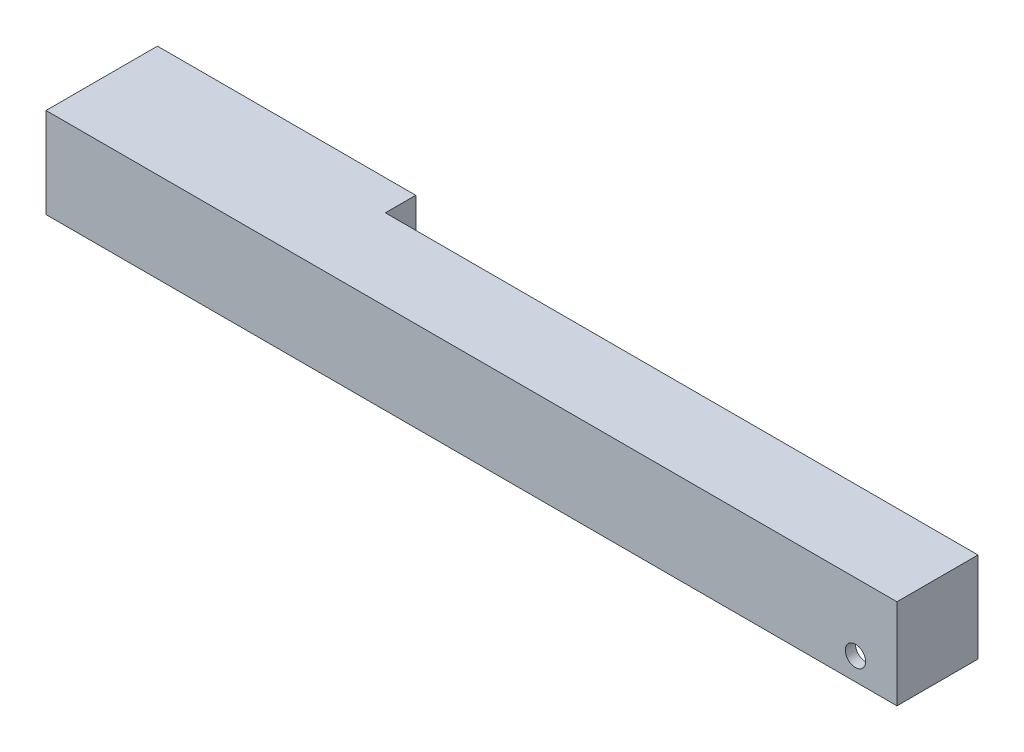
from build123d import *

# Parameters (mm, degrees)
SKETCH1_W           = 168
SKETCH1_H           = 22
BOSS_EXTRUDE1_DEPTH = 17.8
SKETCH8_R           = 2
CUT_EXTRUDE4_DEPTH  = 22
CUT_EXTRUDE2_REACH  = 88.567
SKETCH5_W           = 117
SKETCH5_H           = 6
CUT_EXTRUDE3_DEPTH  = 15.8
BOSS_EXTRUDE3_REACH = 90.164
SKETCH7_W           = 47
SKETCH7_H           = 2


with BuildPart() as part:
    # Sketch1 → Boss-Extrude1 (new body)
    with BuildSketch(Plane(origin=(0, 0, 0), x_dir=(1, 0, 0), z_dir=(0, 1, 0))):
        Rectangle(SKETCH1_W, SKETCH1_H)
    extrude(amount=-BOSS_EXTRUDE1_DEPTH)

    # Sketch8 → Cut-Extrude4 (cut)
    with BuildSketch(Plane.XY.offset(11)):
        with Locations((75.8, -13.35)):
            Circle(SKETCH8_R)
    extrude(amount=-CUT_EXTRUDE4_DEPTH, mode=Mode.SUBTRACT)

    # Cut-Extrude2: up to this face of the body (flat: up to its plane)
    cut_extrude2_end = Plane(part.part.faces().sort_by_distance((0, -17.8, 0))[0])
    # Sketch5 → Cut-Extrude2 (cut, up to the picked face)
    with BuildSketch(Plane(origin=(0, 0, 0), x_dir=(1, 0, 0), z_dir=(0, 1, 0)), mode=Mode.PRIVATE) as cut_extrude2_sk1:
        with Locations((25.5, 8)):
            Rectangle(SKETCH5_W, SKETCH5_H)
    cut_extrude2_tool1 = split(extrude(cut_extrude2_sk1.sketch, amount=-CUT_EXTRUDE2_REACH, mode=Mode.PRIVATE), bisect_by=cut_extrude2_end, keep=Keep.BOTH, mode=Mode.PRIVATE)
    add(cut_extrude2_tool1.solids().sort_by(Axis((25.5, 0, -8), (0, -1, 0)))[0], mode=Mode.SUBTRACT)

    # Sketch6 → Cut-Extrude3 (cut)
    with BuildSketch(Plane.XZ.offset(17.8)):
        Polygon((-82, 9), (-82, -9), (-35, -9), (-35, -3), (82, -3), (82, 9), align=None)
    extrude(amount=-CUT_EXTRUDE3_DEPTH, mode=Mode.SUBTRACT)

    # Boss-Extrude3: up to this face of the body (flat: up to its plane)
    boss_extrude3_end = Plane(part.part.faces().sort_by_distance((-0.369393652, -9.883187228, 9))[0])
    # Sketch7 → Boss-Extrude3 (add, up to the picked face)
    with BuildSketch(Plane.XY.offset(-9), mode=Mode.PRIVATE) as boss_extrude3_sk1:
        with Locations((-58.5, -13.3)):
            Rectangle(SKETCH7_W, SKETCH7_H)
    boss_extrude3_tool1 = split(extrude(boss_extrude3_sk1.sketch, amount=BOSS_EXTRUDE3_REACH, mode=Mode.PRIVATE), bisect_by=boss_extrude3_end, keep=Keep.BOTH, mode=Mode.PRIVATE)
    add(boss_extrude3_tool1.solids().sort_by(Axis((-58.5, -13.3, -9), (0, 0, 1)))[0])


solid = part.part
